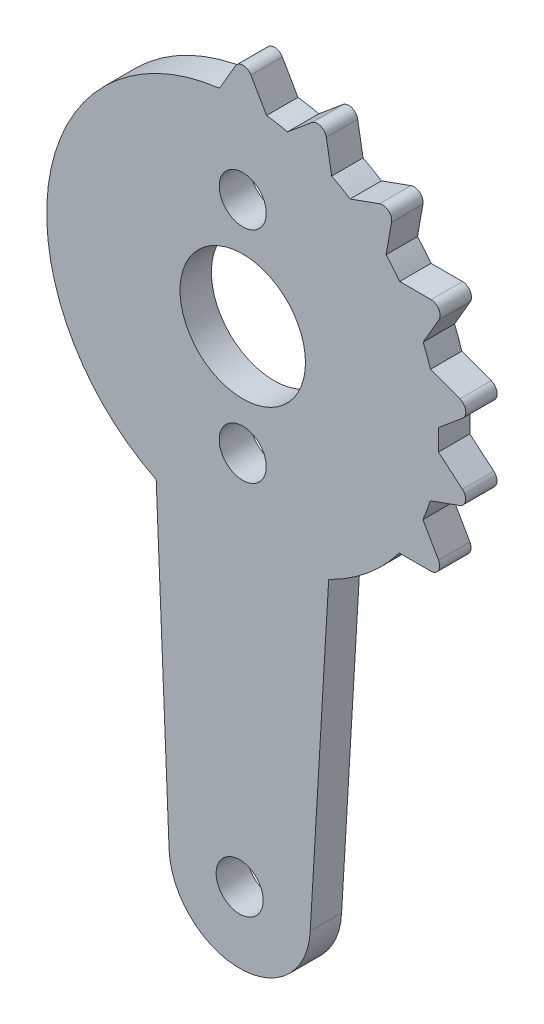
from build123d import *

# Parameters (mm, degrees)
SKETCH1_R           = 4
SKETCH1_R_2         = 1.5
BOSS_EXTRUDE1_DEPTH = 2


with BuildPart() as part:
    # Sketch1 → Boss-Extrude1 (new body)
    with BuildSketch(Plane.XY):
        with BuildLine():
            Line((-5.322767432, 19.832757644), (-4.500006862, -0.184957582))
            ThreePointArc((-4.500006862, -0.184957582), (-0.000167017, -4.503806283), (4.499993132, -0.185291335))
            Line((4.499993132, -0.185291335), (5.67721776, 19.814708665))
            ThreePointArc((5.67721776, 19.814708665), (8.148561948, 21.404983206), (10.180318916, 23.528301089))
            Line((10.180318916, 23.528301089), (12.180312779, 23.523346368))
            ThreePointArc((12.180312779, 23.523346368), (12.679597114, 23.812434692), (12.680312779, 24.389371772))
            Line((12.680312779, 24.389371772), (11.684612917, 26.123898158))
            ThreePointArc((11.684612917, 26.123898158), (11.934719035, 26.754030681), (12.150293859, 27.396796239))
            Line((12.150293859, 27.396796239), (14.031367948, 28.076178512))
            ThreePointArc((14.031367948, 28.076178512), (14.401667723, 28.518597977), (14.205016126, 29.060986265))
            Line((14.205016126, 29.060986265), (12.67612135, 30.350358501))
            ThreePointArc((12.67612135, 30.350358501), (12.695626208, 31.028030714), (12.678361511, 31.705763698))
            Line((12.678361511, 31.705763698), (14.213630529, 32.987539436))
            ThreePointArc((14.213630529, 32.987539436), (14.410282126, 33.529927724), (14.039982351, 33.972347189))
            Line((14.039982351, 33.972347189), (12.162299935, 34.661047954))
            ThreePointArc((12.162299935, 34.661047954), (11.948850959, 35.304522586), (11.700829119, 35.935478396))
            Line((11.700829119, 35.935478396), (12.705116964, 37.665046528))
            ThreePointArc((12.705116964, 37.665046528), (12.704401299, 38.241983607), (12.205116964, 38.531071932))
            Line((12.205116964, 38.531071932), (10.205123119, 38.536033749))
            ThreePointArc((10.205123119, 38.536033749), (9.784465406, 39.067698263), (9.335601516, 39.575774317))
            Line((9.335601516, 39.575774317), (9.687776253, 41.5445234))
            ThreePointArc((9.687776253, 41.5445234), (9.489779645, 42.086422145), (8.92173181, 42.18731101))
            Line((8.92173181, 42.18731101), (7.040655311, 41.507935412))
            ThreePointArc((7.040655311, 41.507935412), (6.463526388, 41.863663221), (5.867960059, 42.187578047))
            Line((5.867960059, 42.187578047), (5.525544216, 44.158047887))
            ThreePointArc((5.525544216, 44.158047887), (5.154147979, 44.59954731), (4.585851596, 44.500068031))
            Line((4.585851596, 44.500068031), (3.050578029, 43.21829774))
            ThreePointArc((3.050578029, 43.21829774), (2.386588163, 43.355182821), (1.716153483, 43.455867511))
            Line((1.716153483, 43.455867511), (0.720447466, 45.190390364))
            ThreePointArc((0.720447466, 45.190390364), (0.220447466, 45.47823912), (-0.279552534, 45.190390364))
            Line((-0.279552534, 45.190390364), (-1.283846517, 43.460825796))
            ThreePointArc((-1.283846517, 43.460825796), (-12.125641313, 33.154858755), (-5.322767432, 19.832757644))
        make_face()
        with Locations((0.19564328, 31.048690205)):
            Circle(SKETCH1_R, mode=Mode.SUBTRACT)
        with Locations((0.19564328, 38.048690205)):
            Circle(SKETCH1_R_2, mode=Mode.SUBTRACT)
        with Locations((0.19564328, 24.048690205)):
            Circle(SKETCH1_R_2, mode=Mode.SUBTRACT)
        Circle(SKETCH1_R_2, mode=Mode.SUBTRACT)
    extrude(amount=BOSS_EXTRUDE1_DEPTH)


solid = part.part
